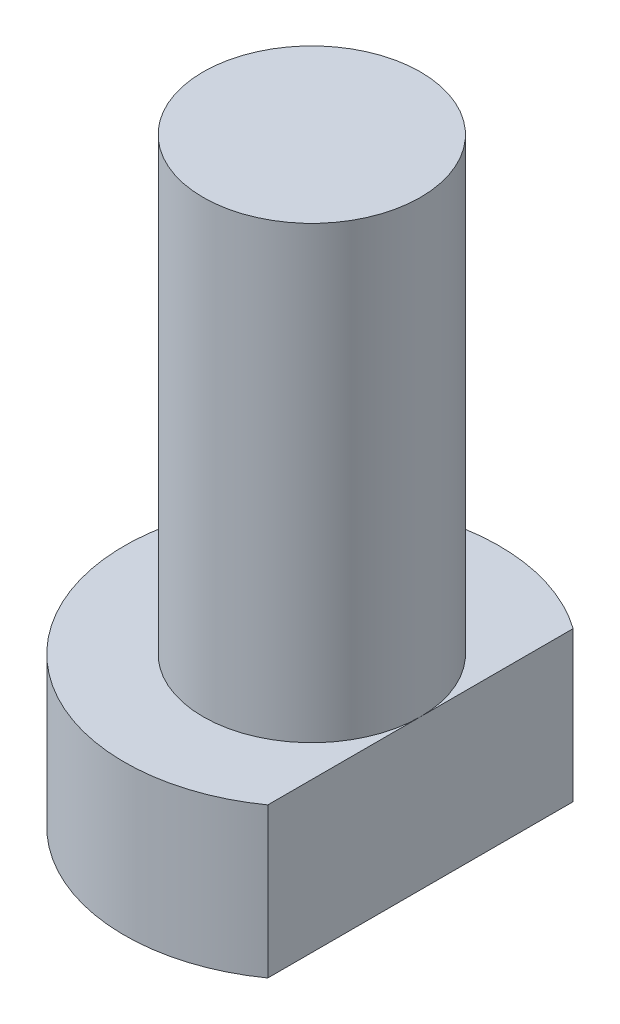
from build123d import *

# Parameters (mm, degrees)
SKETCH1_R           = 2.5
BOSS_EXTRUDE1_DEPTH = 2
SKETCH2_R           = 1.45
BOSS_EXTRUDE2_DEPTH = 6
CUT_EXTRUDE1_START  = -6
CUT_EXTRUDE1_DEPTH  = 6


with BuildPart() as part:
    # Sketch1 → Boss-Extrude1 (new body)
    with BuildSketch(Plane(origin=(0, 0, 0), x_dir=(1, 0, 0), z_dir=(0, 1, 0))):
        with Locations(Location((0, 0, 0), (0, 0, 270))):
            Circle(SKETCH1_R)
    extrude(amount=BOSS_EXTRUDE1_DEPTH)

    # Sketch2 → Boss-Extrude2 (add)
    with BuildSketch(Plane(origin=(0, 2, 0), x_dir=(1, 0, 0), z_dir=(0, 1, 0))):
        with Locations(Location((0, 0, 0), (0, 0, 270))):
            Circle(SKETCH2_R)
    extrude(amount=BOSS_EXTRUDE2_DEPTH)

    # Sketch3 → Cut-Extrude1 (cut)
    with BuildSketch(Plane(origin=(0, 2, 0), x_dir=(1, 0, 0), z_dir=(0, 1, 0)).offset(CUT_EXTRUDE1_START)):
        with BuildLine():
            Line((1.45, 2.036541185), (1.45, -2.036541185))
            ThreePointArc((1.45, -2.036541185), (2.5, 0), (1.45, 2.036541185))
        make_face()
    extrude(amount=CUT_EXTRUDE1_DEPTH, mode=Mode.SUBTRACT)


solid = part.part
